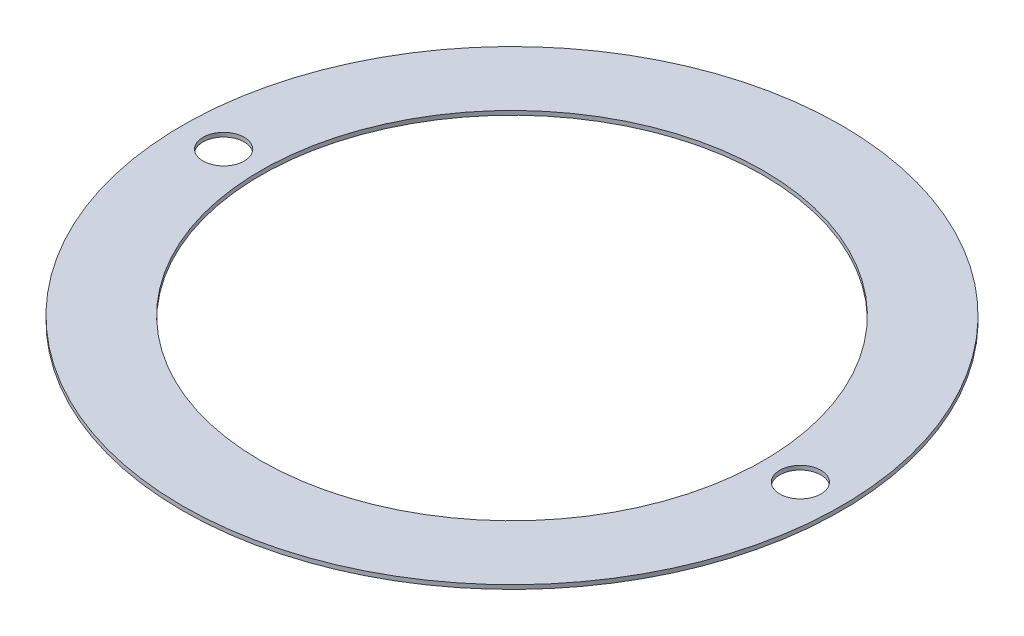
from build123d import *

# Parameters (mm, degrees)
SKETCH1_R                = 8
SKETCH1_R_2              = 6.1
BOSS_EXTRUDE1_DEPTH      = 0.1
F_1_0_1_DIAMETER_HOLE1_D = 1


with BuildPart() as part:
    # Sketch1 → Boss-Extrude1 (new body)
    with BuildSketch(Plane(origin=(0, 0, 0), x_dir=(1, 0, 0), z_dir=(0, 1, 0))):
        with Locations(Location((0, 0, 0), (0, 0, 270))):
            Circle(SKETCH1_R)
        with Locations(Location((0, 0, 0), (0, 0, 270))):
            Circle(SKETCH1_R_2, mode=Mode.SUBTRACT)
    extrude(amount=BOSS_EXTRUDE1_DEPTH)

    # Ø1.0 (1) Diameter Hole1 (through all)
    with Locations(Plane(origin=(0, 0.1, 0), x_dir=(1, 0, 0), z_dir=(0, 1, 0))):
        with Locations((-7, 0), (7, 0)):
            Hole(F_1_0_1_DIAMETER_HOLE1_D / 2)


solid = part.part
